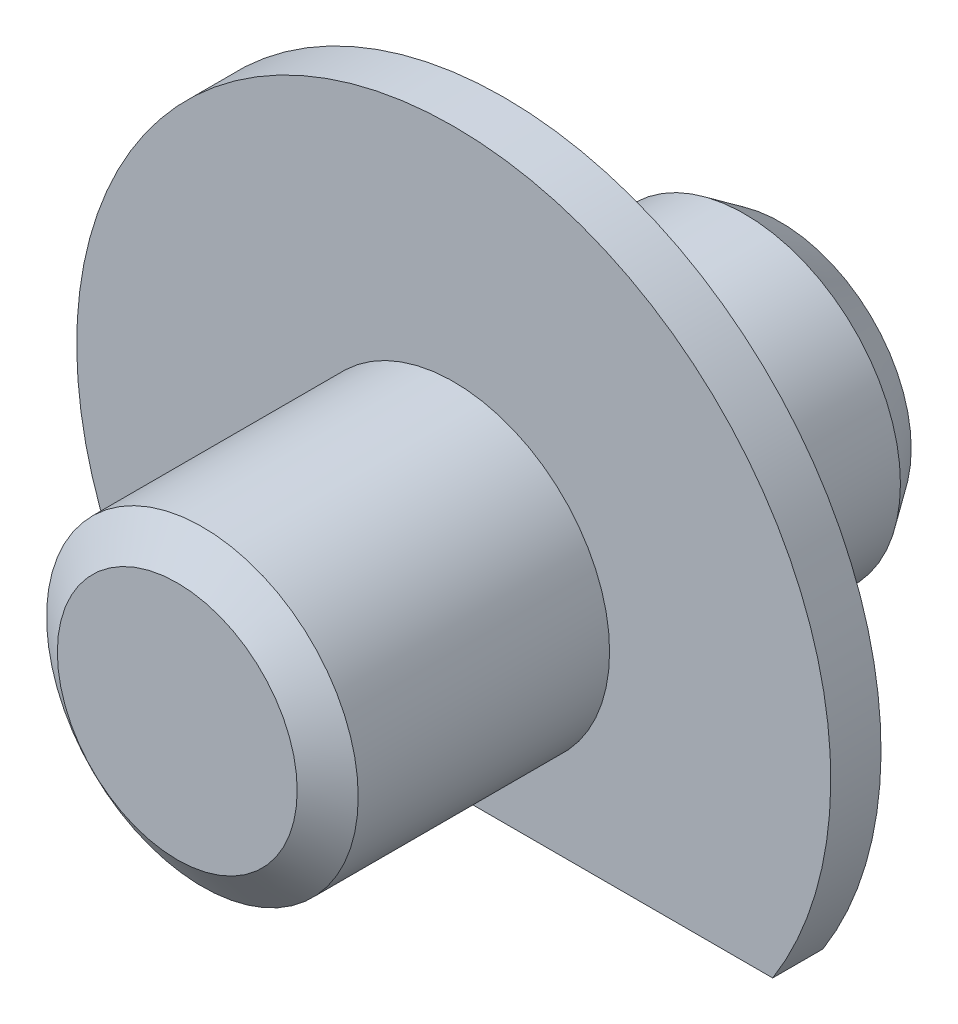
from build123d import *
from OCP.BRepFilletAPI import BRepFilletAPI_MakeChamfer

# Parameters (mm, degrees)
SKETCH1_R                = 3.1
BOSS_EXTRUDE1_DEPTH      = 12
CHAMFER1_SIZE            = 0.5
CHAMFER1_SIZE2           = 0.714074003
BOSS_EXTRUDE2_DEPTH      = 0.5
BOSS_EXTRUDE2_DEPTH_BACK = 0.5


with BuildPart() as part:
    # Sketch1 → Boss-Extrude1 (new body)
    with BuildSketch(Plane.XY):
        Circle(SKETCH1_R)
    extrude(amount=BOSS_EXTRUDE1_DEPTH)

    # Chamfer1: one chamfer whose edges measure the first distance from different faces: ONE call of the kernel's chamfer builder (chamfer() names one face for all edges)
    chamfer1_edges_1 = [part.edges().sort_by_distance(p)[0] for p in [
        (-3.1, 0, 0),
    ]]
    chamfer1_side_1 = [part.faces().sort_by_distance(p)[0] for p in [
        (0, 0, 0),
    ]]
    chamfer1_edges_2 = [part.edges().sort_by_distance(p)[0] for p in [
        (-3.1, 0, 12),
    ]]
    chamfer1_side_2 = [part.faces().sort_by_distance(p)[0] for p in [
        (-3.1, 0, 6),
    ]]
    chamfer1 = BRepFilletAPI_MakeChamfer(part.part.solid().wrapped)
    for e in chamfer1_edges_1:
        chamfer1.Add(CHAMFER1_SIZE, CHAMFER1_SIZE2, e.wrapped, chamfer1_side_1[0].wrapped)  # the first distance lies on this face
    for e in chamfer1_edges_2:
        chamfer1.Add(CHAMFER1_SIZE, CHAMFER1_SIZE2, e.wrapped, chamfer1_side_2[0].wrapped)  # the first distance lies on this face
    add(Compound.cast(chamfer1.Shape()), mode=Mode.REPLACE)

    # Sketch2 → Boss-Extrude2 (add, two sides: drawn at the far end of the back side and taken through both)
    with BuildSketch(Plane.XY.offset(6).offset(-BOSS_EXTRUDE2_DEPTH_BACK)):
        with BuildLine():
            Line((-6.34428877, -4), (6.34428877, -4))
            ThreePointArc((6.34428877, -4), (0, 7.5), (-6.34428877, -4))
        make_face()
    extrude(amount=BOSS_EXTRUDE2_DEPTH + BOSS_EXTRUDE2_DEPTH_BACK)


solid = part.part
